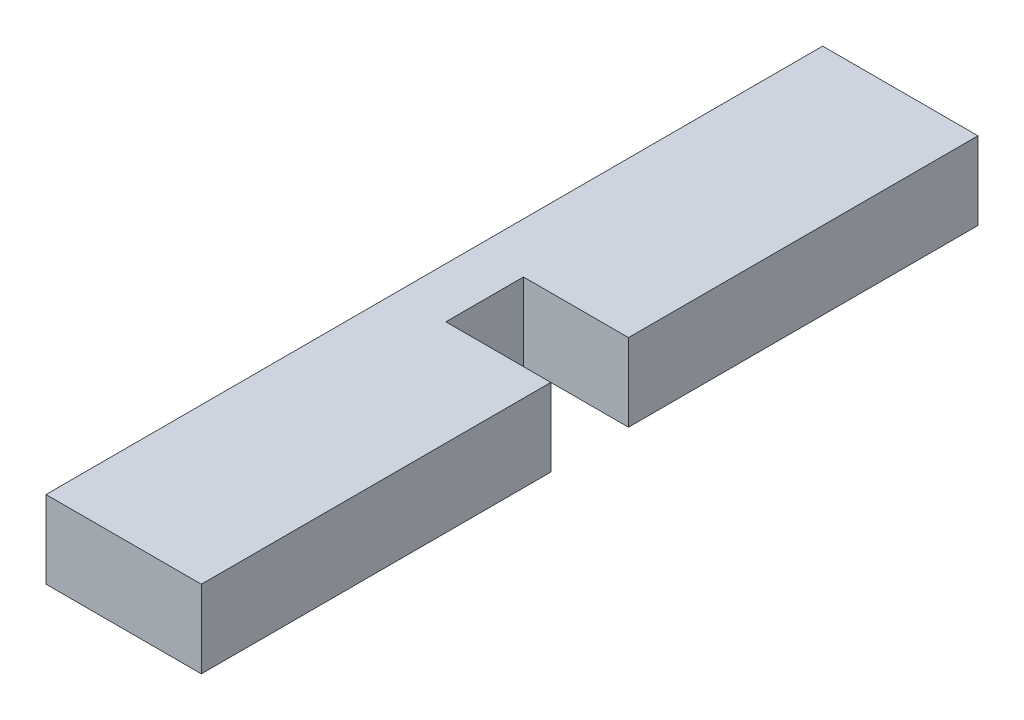
from build123d import *

# Parameters (mm, degrees)
SKETCH1_W           = 10
SKETCH1_H           = 50
BOSS_EXTRUDE1_DEPTH = 5
CUT_EXTRUDE1_DEPTH  = 26.980762114


with BuildPart() as part:
    # Sketch1 → Boss-Extrude1 (new body)
    with BuildSketch(Plane(origin=(0, 0, 0), x_dir=(1, 0, 0), z_dir=(0, 1, 0))):
        Rectangle(SKETCH1_W, SKETCH1_H)
    extrude(amount=BOSS_EXTRUDE1_DEPTH)

    # Sketch2 → Cut-Extrude1 (cut, through all)
    with BuildSketch(Plane(origin=(0, 5, 0), x_dir=(1, 0, 0), z_dir=(0, 1, 0))):
        Polygon((5, 0), (5, 2.5), (-1.759454012, 2.5), (-1.759454012, -2.5), (5, -2.5), align=None)
    extrude(amount=-CUT_EXTRUDE1_DEPTH, mode=Mode.SUBTRACT)


solid = part.part
